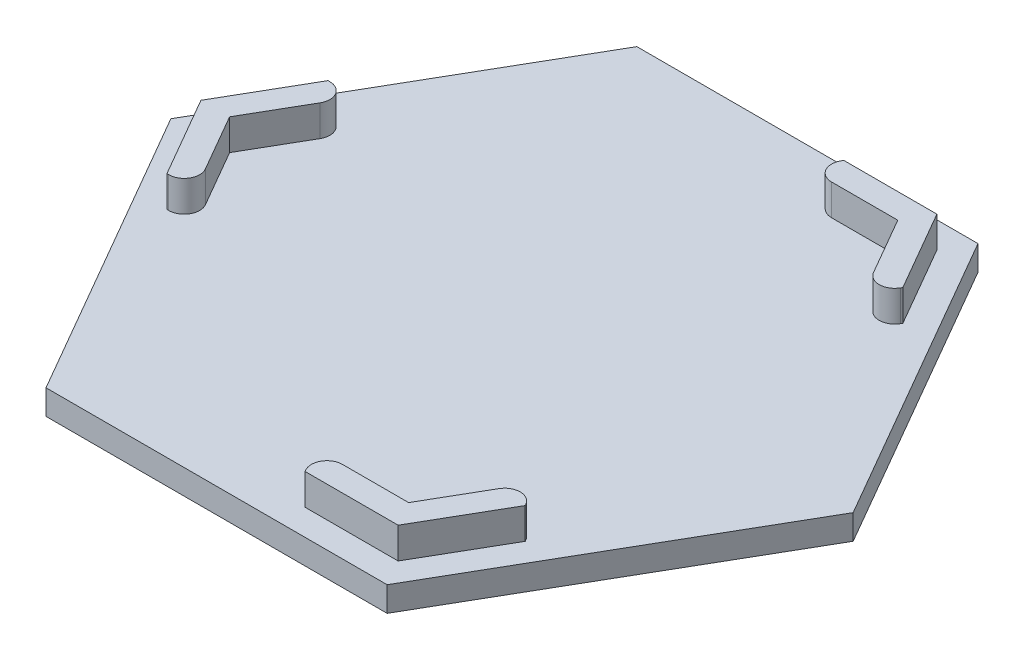
from build123d import *

# Parameters (mm, degrees)
BOSS_EXTRUDE1_DEPTH = 2.032
BOSS_EXTRUDE2_DEPTH = 2.54
FILLET2_R           = 1.27


with BuildPart() as part:
    # Sketch1 → Boss-Extrude1 (new body)
    with BuildSketch(Plane(origin=(0, 0, 0), x_dir=(1, 0, 0), z_dir=(0, 1, 0))):
        Polygon((27.94, 0), (13.97, 24.196749782), (-13.97, 24.196749782), (-27.94, 0), (-13.97, -24.196749782), (13.97, -24.196749782), align=None)
    extrude(amount=BOSS_EXTRUDE1_DEPTH)

    # Sketch2 → Boss-Extrude2 (add)
    with BuildSketch(Plane(origin=(0, 2.032, 0), x_dir=(1, 0, 0), z_dir=(0, 1, 0))):
        Polygon((11.564989719, -20.031149782), (3.944989719, -20.031149782), (5.118165466, -22.063149782), (12.738165466, -22.063149782), (16.548165466, -15.464036205), (15.374989719, -13.432036205), align=None)
        Polygon((-23.129979437, 0), (-19.319979437, 6.599113577), (-21.666330931, 6.599113577), (-25.476330931, 0), (-21.666330931, -6.599113577), (-19.319979437, -6.599113577), align=None)
        Polygon((5.118165466, 22.063149782), (3.944989719, 20.031149782), (11.564989719, 20.031149782), (15.374989719, 13.432036205), (16.548165466, 15.464036205), (12.738165466, 22.063149782), align=None)
    extrude(amount=BOSS_EXTRUDE2_DEPTH)

    # Fillet2
    fillet2_edges = [part.edges().sort_by_distance(p)[0] for p in [
        (15.374989719, 3.302, -13.432036205),
        (3.944989719, 3.302, -20.031149782),
        (15.374989719, 3.302, 13.432036205),
        (3.944989719, 3.302, 20.031149782),
        (-19.319979437, 3.302, 6.599113577),
        (-19.319979437, 3.302, -6.599113577),
    ]]
    fillet(fillet2_edges, radius=FILLET2_R)


solid = part.part
